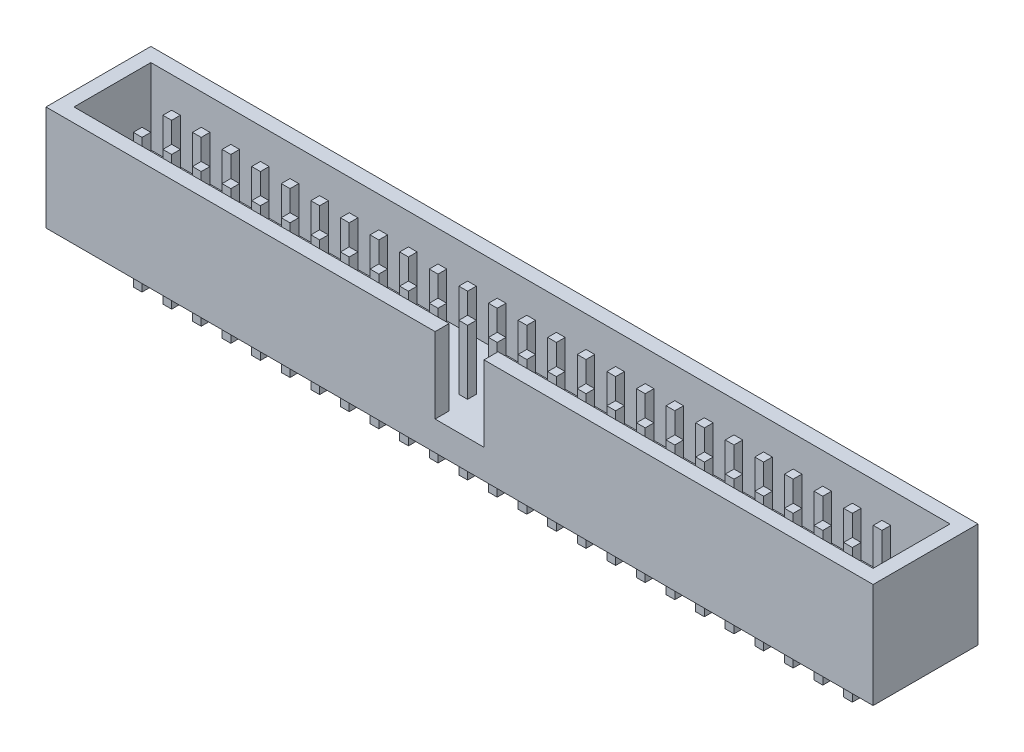
from build123d import *

# Parameters (mm, degrees)
SKETCH_1_W             = 70.98
SKETCH_1_H             = 9
EXTRUDE_1_DEPTH        = 9
SKETCH_2_W             = 68.58
SKETCH_2_H             = 6.6
CUT_EXTRUDE_1_DEPTH    = 6.5
SKETCH_3_W             = 4.2
SKETCH_3_H             = 6.5
CUT_EXTRUDE_2_DEPTH    = 6.5
EXTRUDE_1_2_DEPTH      = 3.5
EXTRUDE_1_2_DEPTH_BACK = 8
SKETCH_6_W             = 0.75
SKETCH_6_H             = 0.75


with BuildPart() as part:
    # 草图1 → Extrude 1 (new body)
    with BuildSketch(Plane(origin=(0, 0, 0), x_dir=(1, 0, 0), z_dir=(0, 1, 0))):
        Rectangle(SKETCH_1_W, SKETCH_1_H)
    extrude(amount=EXTRUDE_1_DEPTH)

    # 草图2 → 切除-拉伸1 (cut)
    with BuildSketch(Plane(origin=(0, 9, 0), x_dir=(-1, 0, 0), z_dir=(0, 1, 0))):
        Rectangle(SKETCH_2_W, SKETCH_2_H)
    extrude(amount=-CUT_EXTRUDE_1_DEPTH, mode=Mode.SUBTRACT)

    # 草图3 → 切除-拉伸2 (cut)
    with BuildSketch(Plane.XY.offset(4.5)):
        with Locations((0, 5.75)):
            Rectangle(SKETCH_3_W, SKETCH_3_H)
    extrude(amount=-CUT_EXTRUDE_2_DEPTH, mode=Mode.SUBTRACT)

    # 草图6 → Extrude 1 2 (add, two sides: drawn at the far end of the back side and taken through both)
    with BuildSketch(Plane.XZ.offset(-EXTRUDE_1_2_DEPTH_BACK)):
        with Locations((30.475, 1.265)):
            Rectangle(SKETCH_6_W, SKETCH_6_H)
        with Locations((27.935, 1.265)):
            Rectangle(SKETCH_6_W, SKETCH_6_H)
        with Locations((25.395, 1.265)):
            Rectangle(SKETCH_6_W, SKETCH_6_H)
        with Locations((22.855, 1.265)):
            Rectangle(SKETCH_6_W, SKETCH_6_H)
        with Locations((20.315, 1.265)):
            Rectangle(SKETCH_6_W, SKETCH_6_H)
        with Locations((17.775, 1.265)):
            Rectangle(SKETCH_6_W, SKETCH_6_H)
        with Locations((15.235, 1.265)):
            Rectangle(SKETCH_6_W, SKETCH_6_H)
        with Locations((12.695, 1.265)):
            Rectangle(SKETCH_6_W, SKETCH_6_H)
        with Locations((10.155, 1.265)):
            Rectangle(SKETCH_6_W, SKETCH_6_H)
        with Locations((7.615, 1.265)):
            Rectangle(SKETCH_6_W, SKETCH_6_H)
        with Locations((5.075, 1.265)):
            Rectangle(SKETCH_6_W, SKETCH_6_H)
        with Locations((2.535, 1.265)):
            Rectangle(SKETCH_6_W, SKETCH_6_H)
        with Locations((-0.005, 1.265)):
            Rectangle(SKETCH_6_W, SKETCH_6_H)
        with Locations((-2.545, 1.265)):
            Rectangle(SKETCH_6_W, SKETCH_6_H)
        with Locations((-5.085, 1.265)):
            Rectangle(SKETCH_6_W, SKETCH_6_H)
        with Locations((-7.625, 1.265)):
            Rectangle(SKETCH_6_W, SKETCH_6_H)
        with Locations((-10.165, 1.265)):
            Rectangle(SKETCH_6_W, SKETCH_6_H)
        with Locations((-12.705, 1.265)):
            Rectangle(SKETCH_6_W, SKETCH_6_H)
        with Locations((-15.245, 1.265)):
            Rectangle(SKETCH_6_W, SKETCH_6_H)
        with Locations((-17.785, 1.265)):
            Rectangle(SKETCH_6_W, SKETCH_6_H)
        with Locations((-20.325, 1.265)):
            Rectangle(SKETCH_6_W, SKETCH_6_H)
        with Locations((-22.865, 1.265)):
            Rectangle(SKETCH_6_W, SKETCH_6_H)
        with Locations((-25.405, 1.265)):
            Rectangle(SKETCH_6_W, SKETCH_6_H)
        with Locations((-27.945, 1.265)):
            Rectangle(SKETCH_6_W, SKETCH_6_H)
        with Locations((-30.485, 1.265)):
            Rectangle(SKETCH_6_W, SKETCH_6_H)
        with Locations((27.935, -1.275)):
            Rectangle(SKETCH_6_W, SKETCH_6_H)
        with Locations((25.395, -1.275)):
            Rectangle(SKETCH_6_W, SKETCH_6_H)
        with Locations((22.855, -1.275)):
            Rectangle(SKETCH_6_W, SKETCH_6_H)
        with Locations((20.315, -1.275)):
            Rectangle(SKETCH_6_W, SKETCH_6_H)
        with Locations((17.775, -1.275)):
            Rectangle(SKETCH_6_W, SKETCH_6_H)
        with Locations((15.235, -1.275)):
            Rectangle(SKETCH_6_W, SKETCH_6_H)
        with Locations((12.695, -1.275)):
            Rectangle(SKETCH_6_W, SKETCH_6_H)
        with Locations((10.155, -1.275)):
            Rectangle(SKETCH_6_W, SKETCH_6_H)
        with Locations((7.615, -1.275)):
            Rectangle(SKETCH_6_W, SKETCH_6_H)
        with Locations((5.075, -1.275)):
            Rectangle(SKETCH_6_W, SKETCH_6_H)
        with Locations((2.535, -1.275)):
            Rectangle(SKETCH_6_W, SKETCH_6_H)
        with Locations((-0.005, -1.275)):
            Rectangle(SKETCH_6_W, SKETCH_6_H)
        with Locations((-2.545, -1.275)):
            Rectangle(SKETCH_6_W, SKETCH_6_H)
        with Locations((-5.085, -1.275)):
            Rectangle(SKETCH_6_W, SKETCH_6_H)
        with Locations((-7.625, -1.275)):
            Rectangle(SKETCH_6_W, SKETCH_6_H)
        with Locations((-10.165, -1.275)):
            Rectangle(SKETCH_6_W, SKETCH_6_H)
        with Locations((-12.705, -1.275)):
            Rectangle(SKETCH_6_W, SKETCH_6_H)
        with Locations((-15.245, -1.275)):
            Rectangle(SKETCH_6_W, SKETCH_6_H)
        with Locations((-17.785, -1.275)):
            Rectangle(SKETCH_6_W, SKETCH_6_H)
        with Locations((-20.325, -1.275)):
            Rectangle(SKETCH_6_W, SKETCH_6_H)
        with Locations((-22.865, -1.275)):
            Rectangle(SKETCH_6_W, SKETCH_6_H)
        with Locations((-25.405, -1.275)):
            Rectangle(SKETCH_6_W, SKETCH_6_H)
        with Locations((-27.945, -1.275)):
            Rectangle(SKETCH_6_W, SKETCH_6_H)
        with Locations((-30.485, -1.275)):
            Rectangle(SKETCH_6_W, SKETCH_6_H)
        with Locations((30.475, -1.275)):
            Rectangle(SKETCH_6_W, SKETCH_6_H)
    extrude(amount=EXTRUDE_1_2_DEPTH + EXTRUDE_1_2_DEPTH_BACK)


solid = part.part
